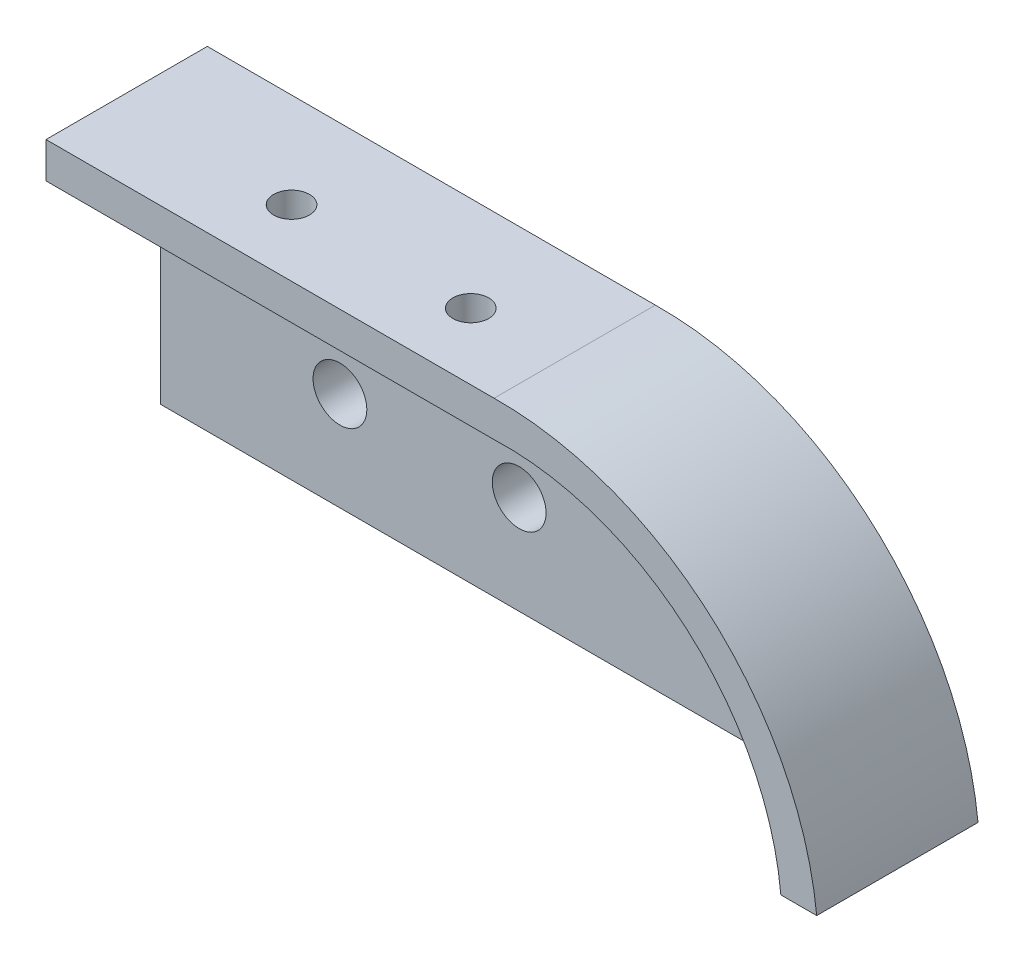
from build123d import *

# Parameters (mm, degrees)
SALIENTE_EXTRUIR1_DEPTH           = 4.5
CORTAR_EXTRUIR1_DEPTH             = 3.2
DI_METRO_DE_TALADRO_1_0_1_1_D     = 1
DI_METRO_DE_TALADRO_1_0_1_1_DEPTH = 8
DI_METRO_DE_TALADRO_1_5_1_5_1_D   = 1.5


with BuildPart() as part:
    # Croquis1 → Saliente-Extruir1 (new body)
    with BuildSketch(Plane.XY.offset(4.5)):
        with BuildLine():
            Line((0, 8), (0, 0))
            Line((0, 0), (21.5, 0))
            ThreePointArc((21.5, 0), (18.55160392, 5.74555441), (12.5, 8))
            Line((12.5, 8), (0, 8))
        make_face()
    extrude(amount=-SALIENTE_EXTRUIR1_DEPTH)

    # Croquis2 → Cortar-Extruir1 (cut)
    with BuildSketch(Plane.XY.offset(4.5)):
        with BuildLine():
            Line((12.5, 7), (0, 7))
            Line((0, 7), (0, 0))
            Line((0, 0), (20.5, 0))
            ThreePointArc((20.5, 0), (17.892764807, 5.091731208), (12.5, 7))
        make_face()
    extrude(amount=-CORTAR_EXTRUIR1_DEPTH, mode=Mode.SUBTRACT)

    # Diámetro de taladro Ø1.0 (1)1
    with Locations(Plane(origin=(0, 8, 0), x_dir=(1, 0, 0), z_dir=(0, 1, 0))):
        with Locations((5, -2.65), (10, -2.65)):
            Hole(DI_METRO_DE_TALADRO_1_0_1_1_D / 2, depth=DI_METRO_DE_TALADRO_1_0_1_1_DEPTH)

    # Diámetro de taladro Ø1.5 (1.5)1 (through all)
    with Locations(Plane.XY.offset(1.3)):
        with Locations((10, 2.75), (5, 2.75)):
            Hole(DI_METRO_DE_TALADRO_1_5_1_5_1_D / 2)


solid = part.part
